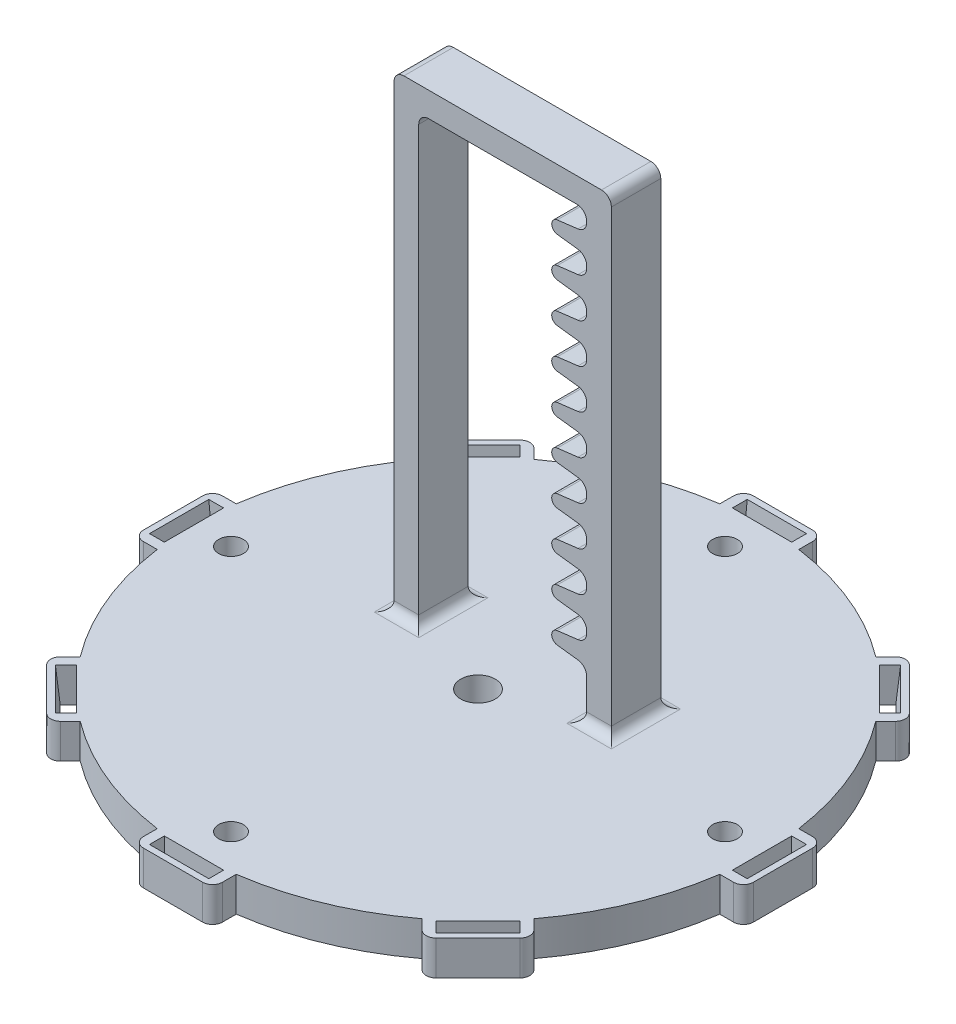
from build123d import *

# Parameters (mm, degrees)
BOSS_EXTRUDE1_DEPTH    = 7
SKETCH2_W              = 5
SKETCH2_H              = 10
BOSS_EXTRUDE2_DEPTH    = 95
SKETCH15_R             = 3.5
CUT_EXTRUDE3_DEPTH     = 7
CIRPATTERN1_COUNT      = 8
SKETCH18_W             = 10
SKETCH18_H             = 5
BOSS_EXTRUDE3_DEPTH    = 34
BOSS_EXTRUDE4_DEPTH    = 10
FILLET1_R              = 2
FILLET2_R              = 2
LPATTERN2_COUNT        = 10
LPATTERN2_PITCH        = 8
FILLET1_OF_LPATTERN2_R = 2
SKETCH20_R             = 2.5
CUT_EXTRUDE4_DEPTH     = 10
CIRPATTERN2_COUNT      = 4


with BuildPart() as part:
    # Sketch1 → Boss-Extrude1 (new body)
    with BuildSketch(Plane(origin=(0, 0, 0), x_dir=(1, 0, 0), z_dir=(0, 1, 0))):
        with BuildLine():
            Line((-8, 56.940758688), (-8, 59.740758688))
            ThreePointArc((-8, 59.740758688), (-7.414213562, 61.154972251), (-6, 61.740758688))
            Line((-6, 61.740758688), (6, 61.740758688))
            ThreePointArc((6, 61.740758688), (7.414213562, 61.154972251), (8, 59.740758688))
            Line((8, 59.740758688), (8, 56.940758688))
            ThreePointArc((8, 56.940758688), (22.004297361, 53.123073119), (34.606342345, 45.920050844))
            Line((34.606342345, 45.920050844), (36.586241332, 47.899949831))
            ThreePointArc((36.586241332, 47.899949831), (38.000454895, 48.485736269), (39.414668457, 47.899949831))
            Line((39.414668457, 47.899949831), (47.899949831, 39.414668457))
            ThreePointArc((47.899949831, 39.414668457), (48.485736269, 38.000454895), (47.899949831, 36.586241332))
            Line((47.899949831, 36.586241332), (45.920050844, 34.606342345))
            ThreePointArc((45.920050844, 34.606342345), (53.123073119, 22.004297361), (56.940758688, 8))
            Line((56.940758688, 8), (59.740758688, 8))
            ThreePointArc((59.740758688, 8), (61.154972251, 7.414213562), (61.740758688, 6))
            Line((61.740758688, 6), (61.740758688, -6))
            ThreePointArc((61.740758688, -6), (61.154972251, -7.414213562), (59.740758688, -8))
            Line((59.740758688, -8), (56.940758688, -8))
            ThreePointArc((56.940758688, -8), (53.123073119, -22.004297361), (45.920050844, -34.606342345))
            Line((45.920050844, -34.606342345), (47.899949831, -36.586241332))
            ThreePointArc((47.899949831, -36.586241332), (48.485736269, -38.000454895), (47.899949831, -39.414668457))
            Line((47.899949831, -39.414668457), (39.414668457, -47.899949831))
            ThreePointArc((39.414668457, -47.899949831), (38.000454895, -48.485736269), (36.586241332, -47.899949831))
            Line((36.586241332, -47.899949831), (34.606342345, -45.920050844))
            ThreePointArc((34.606342345, -45.920050844), (22.004297361, -53.123073119), (8, -56.940758688))
            Line((8, -56.940758688), (8, -59.740758688))
            ThreePointArc((8, -59.740758688), (7.414213562, -61.154972251), (6, -61.740758688))
            Line((6, -61.740758688), (-6, -61.740758688))
            ThreePointArc((-6, -61.740758688), (-7.414213562, -61.154972251), (-8, -59.740758688))
            Line((-8, -59.740758688), (-8, -56.940758688))
            ThreePointArc((-8, -56.940758688), (-22.004297361, -53.123073119), (-34.606342345, -45.920050844))
            Line((-34.606342345, -45.920050844), (-36.586241332, -47.899949831))
            ThreePointArc((-36.586241332, -47.899949831), (-38.000454895, -48.485736269), (-39.414668457, -47.899949831))
            Line((-39.414668457, -47.899949831), (-47.899949831, -39.414668457))
            ThreePointArc((-47.899949831, -39.414668457), (-48.485736269, -38.000454895), (-47.899949831, -36.586241332))
            Line((-47.899949831, -36.586241332), (-45.920050844, -34.606342345))
            ThreePointArc((-45.920050844, -34.606342345), (-53.123073119, -22.004297361), (-56.940758688, -8))
            Line((-56.940758688, -8), (-59.740758688, -8))
            ThreePointArc((-59.740758688, -8), (-61.154972251, -7.414213562), (-61.740758688, -6))
            Line((-61.740758688, -6), (-61.740758688, 6))
            ThreePointArc((-61.740758688, 6), (-61.154972251, 7.414213562), (-59.740758688, 8))
            Line((-59.740758688, 8), (-56.940758688, 8))
            ThreePointArc((-56.940758688, 8), (-53.123073119, 22.004297361), (-45.920050844, 34.606342345))
            Line((-45.920050844, 34.606342345), (-47.899949831, 36.586241332))
            ThreePointArc((-47.899949831, 36.586241332), (-48.485736269, 38.000454895), (-47.899949831, 39.414668457))
            Line((-47.899949831, 39.414668457), (-39.414668457, 47.899949831))
            ThreePointArc((-39.414668457, 47.899949831), (-38.000454895, 48.485736269), (-36.586241332, 47.899949831))
            Line((-36.586241332, 47.899949831), (-34.606342345, 45.920050844))
            ThreePointArc((-34.606342345, 45.920050844), (-22.004297361, 53.123073119), (-8, 56.940758688))
        make_face()
    extrude(amount=BOSS_EXTRUDE1_DEPTH)

    # Sketch2 → Boss-Extrude2 (add)
    with BuildSketch(Plane(origin=(0, 7, 0), x_dir=(1, 0, 0), z_dir=(0, 1, 0))):
        with Locations((19.5, 10)):
            Rectangle(SKETCH2_W, SKETCH2_H)
        with Locations((-19.5, 10)):
            Rectangle(SKETCH2_W, SKETCH2_H)
    extrude(amount=BOSS_EXTRUDE2_DEPTH)

    # Sketch15 → Cut-Extrude3 (cut)
    with BuildSketch(Plane.XZ):
        with Locations(Location((0, 0, 0), (0, 0, 270))):
            Circle(SKETCH15_R)
    extrude(amount=-CUT_EXTRUDE3_DEPTH, mode=Mode.SUBTRACT)

    # Sketch16 → Cut-Loft2 section 0
    with BuildSketch(Plane.XZ):
        with BuildLine():
            Line((-6, 59.8), (6, 59.8))
            Line((6, 59.8), (6, 57.5))
            Line((6, 57.5), (-6, 57.5))
            Line((-6, 57.5), (-6, 59.8))
        make_face()
    # Sketch17 → Cut-Loft2 section 1
    with BuildSketch(Plane(origin=(0, 7, 0), x_dir=(1, 0, 0), z_dir=(0, 1, 0))):
        with BuildLine():
            Line((-6, -57.5), (6, -57.5))
            Line((6, -57.5), (6, -60.5))
            Line((6, -60.5), (-6, -60.5))
            Line((-6, -60.5), (-6, -57.5))
        make_face()
    cut_loft2 = loft(mode=Mode.SUBTRACT)

    # CirPattern1: Cut-Loft2 ×8 about axis
    cirpattern1_axis = Axis((0, 0, 0), (0, 1, 0))
    for i in range(1, CIRPATTERN1_COUNT):
        add(cut_loft2.rotate(cirpattern1_axis, i * 360 / CIRPATTERN1_COUNT), mode=Mode.SUBTRACT)

    # Sketch18 → Boss-Extrude3 (add)
    with BuildSketch(Plane(origin=(-17, 0, 0), x_dir=(0, 0, -1), z_dir=(1, 0, 0))):
        with Locations((10, 99.5)):
            Rectangle(SKETCH18_W, SKETCH18_H)
    extrude(amount=BOSS_EXTRUDE3_DEPTH)

    # Sketch19 → Boss-Extrude4 (add)
    with BuildSketch(Plane(origin=(0, 0, -15), x_dir=(-1, 0, 0), z_dir=(0, 0, -1))):
        with BuildLine():
            Line((-17, 93), (-11.04472309, 92.26878394))
            ThreePointArc((-11.04472309, 92.26878394), (-9.922197884, 91), (-11.04472309, 89.73121606))
            Line((-11.04472309, 89.73121606), (-17, 89))
            Line((-17, 89), (-17, 93))
        make_face()
    boss_extrude4 = extrude(amount=-BOSS_EXTRUDE4_DEPTH)

    # Fillet1
    fillet1_edges = [part.edges().sort_by_distance(p)[0] for p in [
        (17, 89, -10),
        (17, 93, -10),
    ]]
    fillet(fillet1_edges, radius=FILLET1_R)

    # Fillet2
    fillet2_edges = [part.edges().sort_by_distance(p)[0] for p in [
        (22, 7, -10),
        (19.5, 7, -15),
        (17, 7, -10),
        (19.5, 7, -5),
        (22, 102, -10),
        (-17, 7, -10),
        (-19.5, 7, -15),
        (-22, 7, -10),
        (-19.5, 7, -5),
        (-22, 102, -10),
        (-17, 97, -10),
        (17, 97, -10),
    ]]
    fillet(fillet2_edges, radius=FILLET2_R)

    # LPattern2: Boss-Extrude4 ×10
    with Locations(*[(0, -i * LPATTERN2_PITCH, 0) for i in range(1, LPATTERN2_COUNT)]):
        add(boss_extrude4)

    # Fillet1 of LPattern2
    fillet1_of_lpattern2_edges = [part.edges().sort_by_distance(p)[0] for p in [
        (17, 81, -10),
        (17, 85, -10),
        (17, 73, -10),
        (17, 77, -10),
        (17, 65, -10),
        (17, 69, -10),
        (17, 57, -10),
        (17, 61, -10),
        (17, 49, -10),
        (17, 53, -10),
        (17, 41, -10),
        (17, 45, -10),
        (17, 33, -10),
        (17, 37, -10),
        (17, 25, -10),
        (17, 29, -10),
        (17, 17, -10),
        (17, 21, -10),
    ]]
    fillet(fillet1_of_lpattern2_edges, radius=FILLET1_OF_LPATTERN2_R)

    # Sketch20 → Cut-Extrude4 (cut)
    with BuildSketch(Plane(origin=(0, 7, 0), x_dir=(1, 0, 0), z_dir=(0, 1, 0))):
        with Locations(Location((0, 50, 0), (0, 0, 270))):
            Circle(SKETCH20_R)
    cut_extrude4 = extrude(amount=-CUT_EXTRUDE4_DEPTH, mode=Mode.SUBTRACT)

    # CirPattern2: Cut-Extrude4 ×4 about axis
    cirpattern2_axis = Axis((0, 0, 0), (0, 1, 0))
    for i in range(1, CIRPATTERN2_COUNT):
        add(cut_extrude4.rotate(cirpattern2_axis, i * 360 / CIRPATTERN2_COUNT), mode=Mode.SUBTRACT)


solid = part.part
